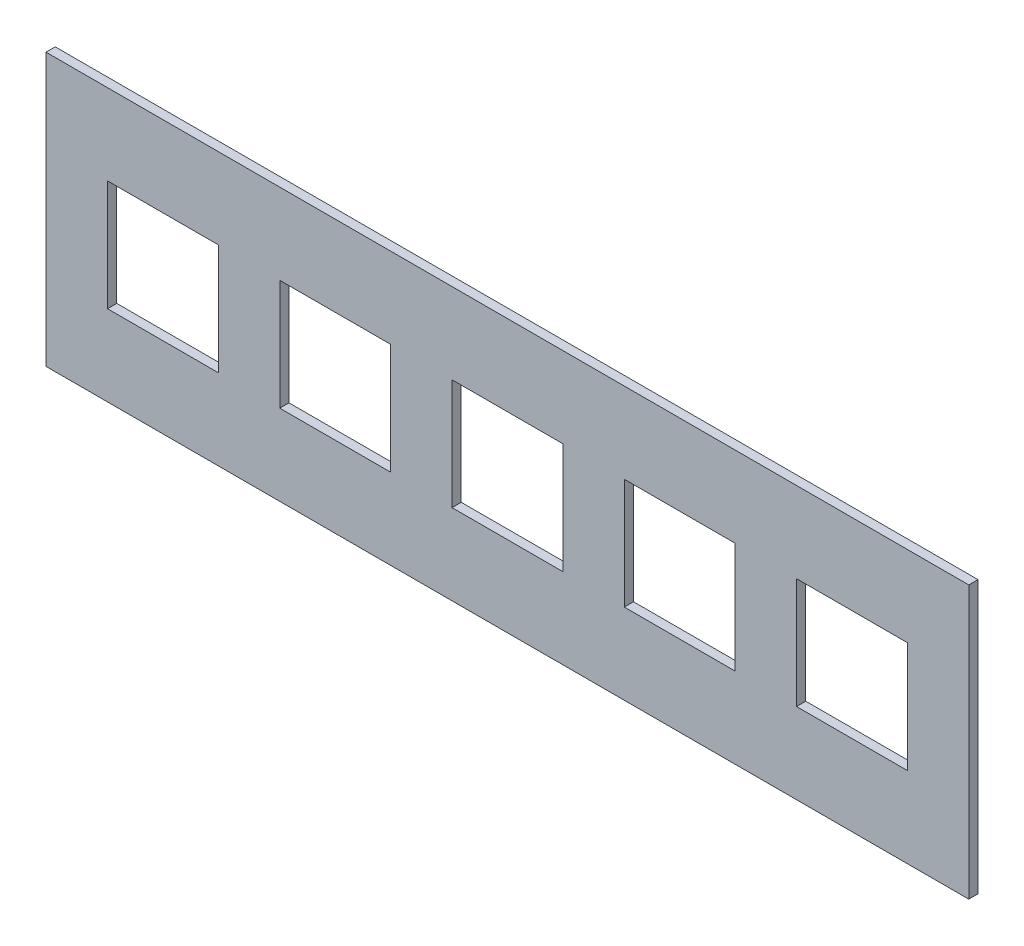
from build123d import *

# Parameters (mm, degrees)
SKETCH1_W           = 300
SKETCH1_H           = 88.48
SKETCH1_W_2         = 36
SKETCH1_H_2         = 36
BOSS_EXTRUDE1_DEPTH = 3


with BuildPart() as part:
    # Sketch1 → Boss-Extrude1 (new body)
    with BuildSketch(Plane.XY):
        Rectangle(SKETCH1_W, SKETCH1_H)
        with Locations((-56, 0)):
            Rectangle(SKETCH1_W_2, SKETCH1_H_2, mode=Mode.SUBTRACT)
        with Locations((-112, 0)):
            Rectangle(SKETCH1_W_2, SKETCH1_H_2, mode=Mode.SUBTRACT)
        Rectangle(SKETCH1_W_2, SKETCH1_H_2, mode=Mode.SUBTRACT)
        with Locations((56, 0)):
            Rectangle(SKETCH1_W_2, SKETCH1_H_2, mode=Mode.SUBTRACT)
        with Locations((112, 0)):
            Rectangle(SKETCH1_W_2, SKETCH1_H_2, mode=Mode.SUBTRACT)
    extrude(amount=BOSS_EXTRUDE1_DEPTH)


solid = part.part
